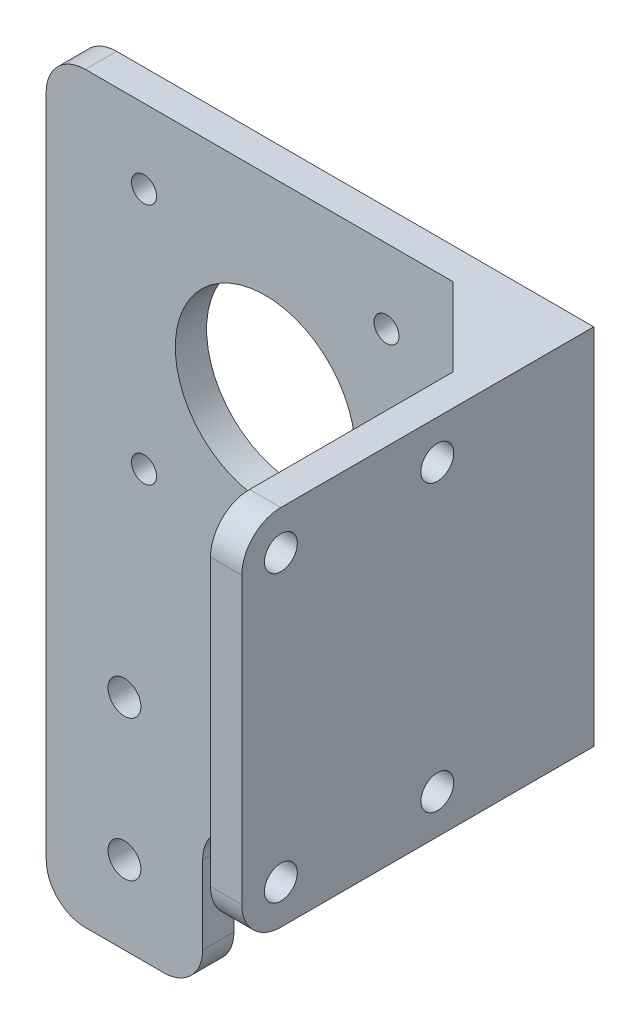
from build123d import *

# Parameters (mm, degrees)
MODEL_R         = 1.5999968
MODEL_R_2       = 2.0999958
MODEL_R_3       = 11.499977
EXTRUDE_1_DEPTH = 4
EXTRUDE_2_DEPTH = 4
FILLET_1_R      = 5
SKETCH_2_R      = 2.1
EXTRUDE_3_DEPTH = 4
EXTRUDE_4_DEPTH = 4


with BuildPart() as part:
    # Model → Бобышка-Вытянуть1 (new body)
    with BuildSketch(Plane.XY):
        with BuildLine():
            Line((274.028195208, 189.164211852), (274.028195208, 151.235355522))
            ThreePointArc((274.028195208, 151.235355522), (273.647593631, 149.321942187), (272.563732042, 147.699828687))
            Line((272.563732042, 147.699828687), (265.492678373, 140.628775017))
            ThreePointArc((265.492678373, 140.628775017), (264.408816784, 139.006661518), (264.028215208, 137.093248183))
            Line((264.028215208, 137.093248183), (264.028215208, 124.164341852))
            ThreePointArc((264.028215208, 124.164341852), (262.563752042, 120.628815017), (259.028225208, 119.164351852))
            Line((259.028225208, 119.164351852), (249.028245208, 119.164351852))
            ThreePointArc((249.028245208, 119.164351852), (245.492718373, 117.699888687), (244.028255208, 114.164361852))
            Line((244.028255208, 114.164361852), (244.028255208, 104.164381852))
            ThreePointArc((244.028255208, 104.164381852), (242.563792042, 100.628855017), (239.028265208, 99.164391852))
            Line((239.028265208, 99.164391852), (229.028285208, 99.164391852))
            ThreePointArc((229.028285208, 99.164391852), (225.492758373, 100.628855017), (224.028295208, 104.164381852))
            Line((224.028295208, 104.164381852), (224.028295208, 189.164211852))
            ThreePointArc((224.028295208, 189.164211852), (225.492758373, 192.699738687), (229.028285208, 194.164201852))
            Line((229.028285208, 194.164201852), (269.028205208, 194.164201852))
            ThreePointArc((269.028205208, 194.164201852), (272.563732043, 192.699738687), (274.028195208, 189.164211852))
        make_face()
        with Locations((267.528208208, 184.664220852)):
            Circle(MODEL_R, mode=Mode.SUBTRACT)
        with Locations((267.528208208, 153.664282852)):
            Circle(MODEL_R, mode=Mode.SUBTRACT)
        with Locations((236.528270208, 153.664282852)):
            Circle(MODEL_R, mode=Mode.SUBTRACT)
        with Locations((236.528270208, 184.664220852)):
            Circle(MODEL_R, mode=Mode.SUBTRACT)
        with Locations((254.028235208, 127.164335852)):
            Circle(MODEL_R_2, mode=Mode.SUBTRACT)
        with Locations((234.028275208, 127.164335852)):
            Circle(MODEL_R_2, mode=Mode.SUBTRACT)
        with Locations((234.028275208, 109.164371852)):
            Circle(MODEL_R_2, mode=Mode.SUBTRACT)
        with Locations((252.028239208, 169.164251852)):
            Circle(MODEL_R_3, mode=Mode.SUBTRACT)
    extrude(amount=EXTRUDE_1_DEPTH)

    # Эскиз1 → Бобышка-Вытянуть2 (add)
    with BuildSketch(Plane(origin=(0, 0, 0), x_dir=(-1, 0, 0), z_dir=(0, 0, -1))):
        Polygon((-274.028195208, 194.164201852), (-286.028195208, 194.164201852), (-286.028195208, 147.699828687), (-274.028195208, 147.699828687), (-271.528200208, 147.699828687), (-271.528200208, 152.064286052), (-274.028195208, 152.064286052), (-274.028195208, 189.164211852), (-269.028205208, 189.164211852), (-269.028205208, 194.164201852), align=None)
    extrude(amount=-EXTRUDE_2_DEPTH)

    # Скругление1
    fillet_1_edges = [part.edges().sort_by_distance(p)[0] for p in [
        (272.563732042, 147.699828687, 2),
    ]]
    fillet(fillet_1_edges, radius=FILLET_1_R)

    # Эскиз2 → Бобышка-Вытянуть3 (add)
    with BuildSketch(Plane(origin=(286.028195208, 0, 0), x_dir=(0, 0, -1), z_dir=(1, 0, 0))):
        with BuildLine():
            Line((0, 147.699828687), (-40, 147.699828687))
            ThreePointArc((-40, 147.699828687), (-43.535533906, 149.164294781), (-45, 152.699828687))
            Line((-45, 152.699828687), (-45, 189.164201852))
            ThreePointArc((-45, 189.164201852), (-43.535533906, 192.699735758), (-40, 194.164201852))
            Line((-40, 194.164201852), (0, 194.164201852))
            Line((0, 194.164201852), (0, 147.699828687))
        make_face()
        with Locations((-40, 189.164201852)):
            Circle(SKETCH_2_R, mode=Mode.SUBTRACT)
        with Locations((-40, 152.699828687)):
            Circle(SKETCH_2_R, mode=Mode.SUBTRACT)
        with Locations((-20, 189.164201852)):
            Circle(SKETCH_2_R, mode=Mode.SUBTRACT)
        with Locations((-20, 152.699828687)):
            Circle(SKETCH_2_R, mode=Mode.SUBTRACT)
    extrude(amount=EXTRUDE_3_DEPTH)

    # Эскиз3 → Бобышка-Вытянуть4 (add)
    with BuildSketch(Plane(origin=(0, 194.164201852, 0), x_dir=(1, 0, 0), z_dir=(0, 1, 0))):
        Polygon((286.028195208, -4), (276.028195208, -4), (286.028195208, -14), align=None)
    extrude_4 = extrude(amount=-EXTRUDE_4_DEPTH)

    # Зеркальное отражение1: Бобышка-Вытянуть4 across plane
    add(extrude_4.mirror(Plane.ZX.offset(170.93201527)))


solid = part.part
